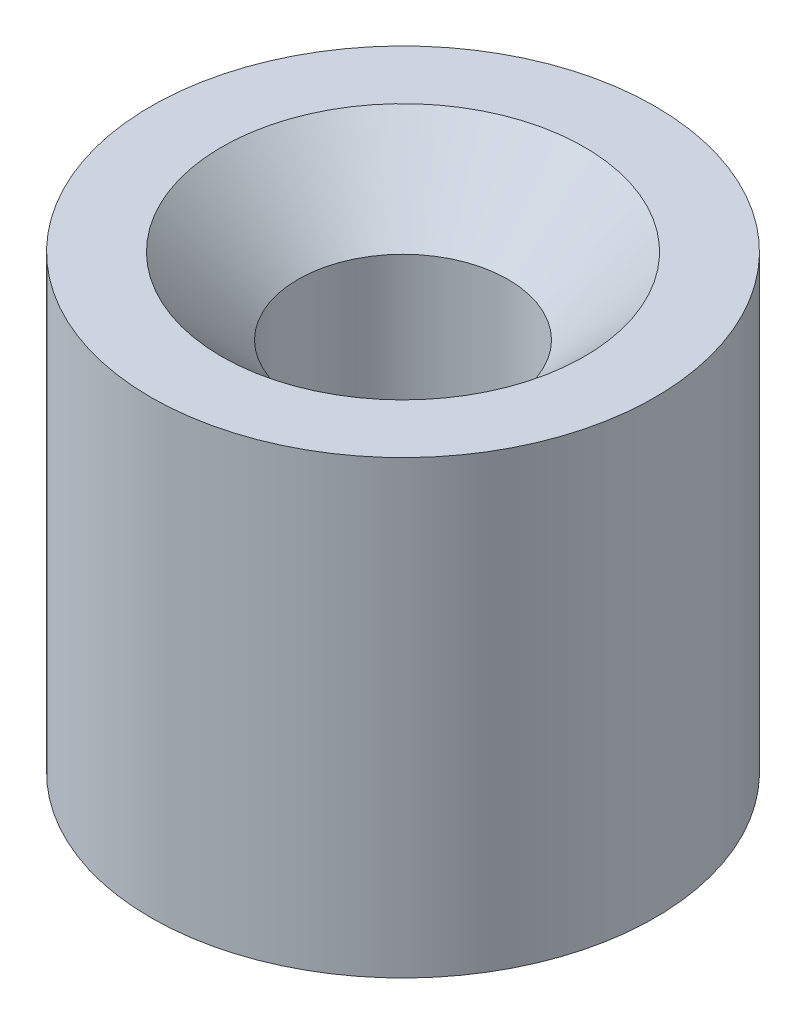
from build123d import *

# Parameters (mm, degrees)
SKETCH1_R           = 6.6
SKETCH1_R_2         = 2.75
BOSS_EXTRUDE1_DEPTH = 11.8
CHAMFER1_SIZE       = 2


with BuildPart() as part:
    # Sketch1 → Boss-Extrude1 (new body)
    with BuildSketch(Plane(origin=(0, 0, 0), x_dir=(1, 0, 0), z_dir=(0, 1, 0))):
        with Locations(Location((0, 0, 0), (0, 0, 270))):
            Circle(SKETCH1_R)
        with Locations(Location((0, 0, 0), (0, 0, 270))):
            Circle(SKETCH1_R_2, mode=Mode.SUBTRACT)
    extrude(amount=BOSS_EXTRUDE1_DEPTH)

    # Chamfer1
    chamfer1_edges = [part.edges().sort_by_distance(p)[0] for p in [
        (0, 0, -2.75),
        (0, 11.8, -2.75),
    ]]
    chamfer(chamfer1_edges, length=CHAMFER1_SIZE)


solid = part.part
